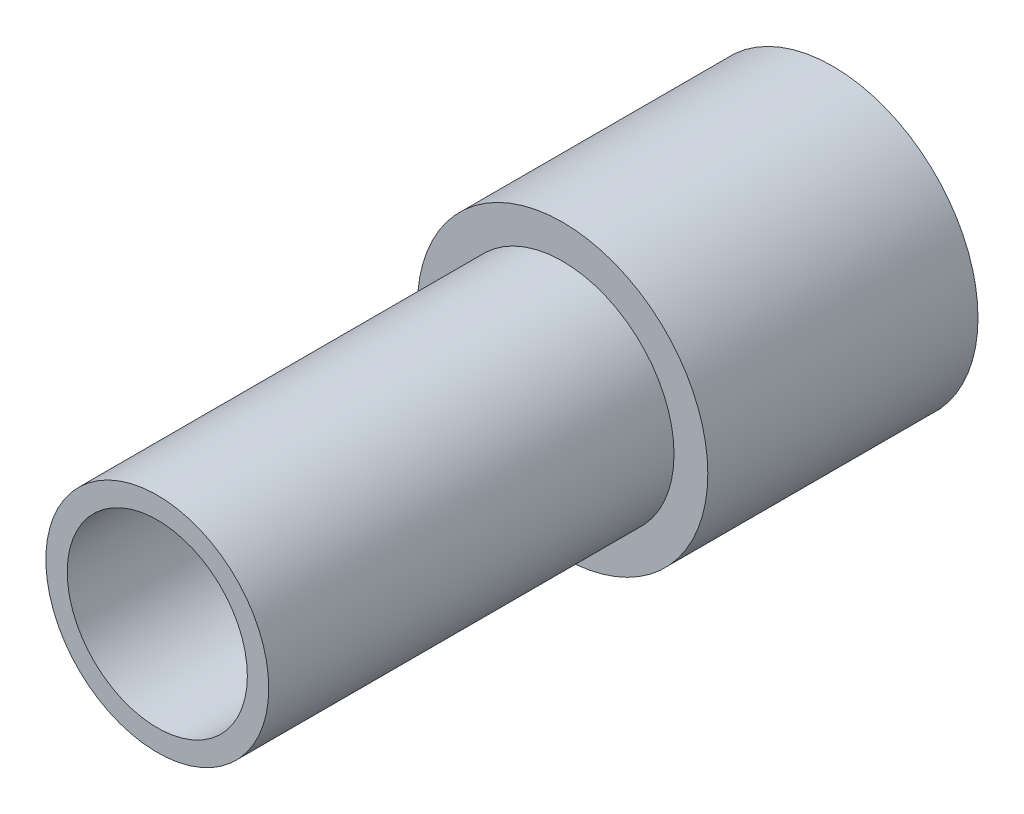
from build123d import *

# Parameters (mm, degrees)
SKETCH1_R           = 6.45
SKETCH1_R_2         = 4
BOSS_EXTRUDE1_DEPTH = 30
CUT_EXTRUDE1_START  = -18
SKETCH2_R           = 6.45
SKETCH2_R_2         = 4.95
CUT_EXTRUDE1_DEPTH  = 18


with BuildPart() as part:
    # Sketch1 → Boss-Extrude1 (new body)
    with BuildSketch(Plane.XY):
        Circle(SKETCH1_R)
        Circle(SKETCH1_R_2, mode=Mode.SUBTRACT)
    extrude(amount=BOSS_EXTRUDE1_DEPTH)

    # Sketch2 → Cut-Extrude1 (cut)
    with BuildSketch(Plane.XY.offset(30).offset(CUT_EXTRUDE1_START)):
        Circle(SKETCH2_R)
        Circle(SKETCH2_R_2, mode=Mode.SUBTRACT)
    extrude(amount=CUT_EXTRUDE1_DEPTH, mode=Mode.SUBTRACT)


solid = part.part
